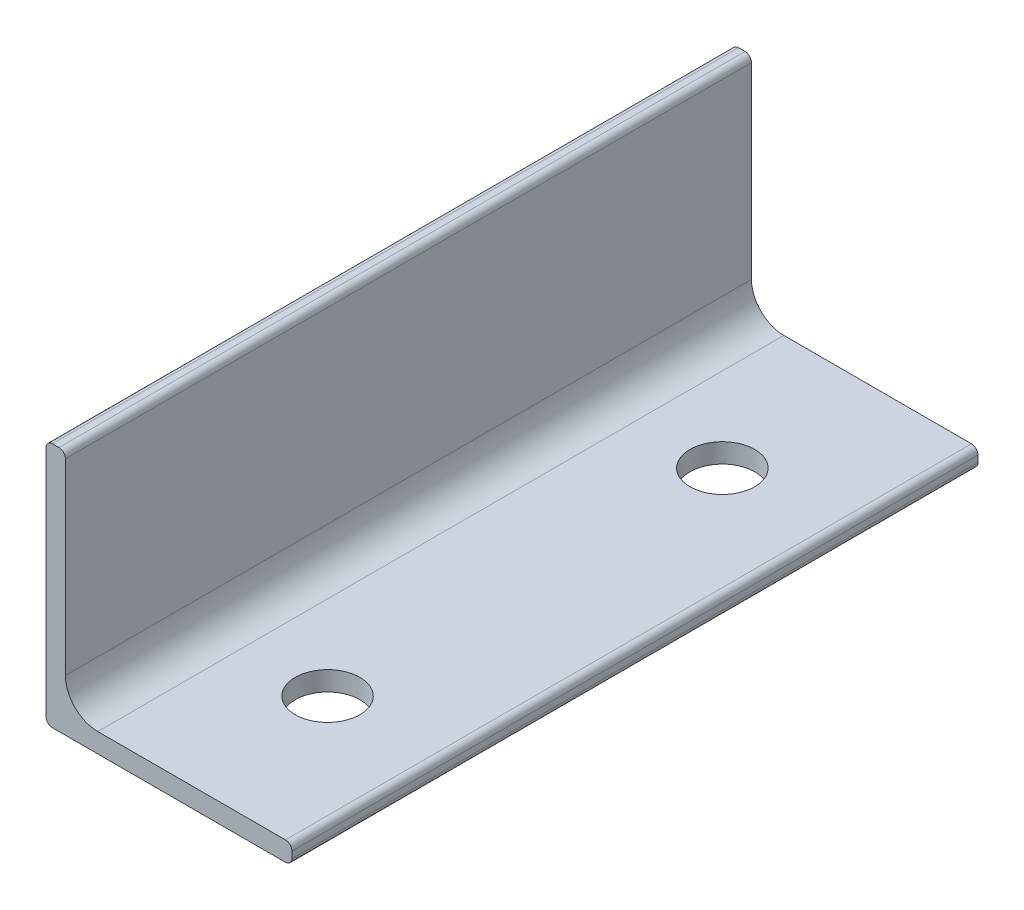
from build123d import *

# Parameters (mm, degrees)
EXTRUDE_1_DEPTH     = 53
SKETCH_3_R          = 5
CUT_EXTRUDE_1_DEPTH = 75.01351228


with BuildPart() as part:
    # 草图1 → 凸台-拉伸1 (new, symmetric)
    with BuildSketch(Plane.XY):
        with BuildLine():
            Line((0, 1), (0, 37))
            ThreePointArc((0, 37), (0.292893219, 37.707106781), (1, 38))
            Line((1, 38), (2, 38))
            ThreePointArc((2, 38), (2.707106781, 37.707106781), (3, 37))
            Line((3, 37), (3, 8))
            ThreePointArc((3, 8), (4.464466094, 4.464466094), (8, 3))
            Line((8, 3), (37, 3))
            ThreePointArc((37, 3), (37.707106781, 2.707106781), (38, 2))
            Line((38, 2), (38, 1))
            ThreePointArc((38, 1), (37.707106781, 0.292893219), (37, 0))
            Line((37, 0), (1, 0))
            ThreePointArc((1, 0), (0.292893219, 0.292893219), (0, 1))
        make_face()
    extrude(amount=EXTRUDE_1_DEPTH, both=True)

    # 草图3 → 切除-拉伸1 (cut, through all)
    with BuildSketch(Plane(origin=(0, 3, 0), x_dir=(1, 0, 0), z_dir=(0, 1, 0))):
        with Locations(Location((21, 30.5, 0), (0, 0, 270))):
            Circle(SKETCH_3_R)
        with Locations(Location((21, -30.5, 0), (0, 0, 270))):
            Circle(SKETCH_3_R)
    extrude(amount=-CUT_EXTRUDE_1_DEPTH, mode=Mode.SUBTRACT)


solid = part.part
